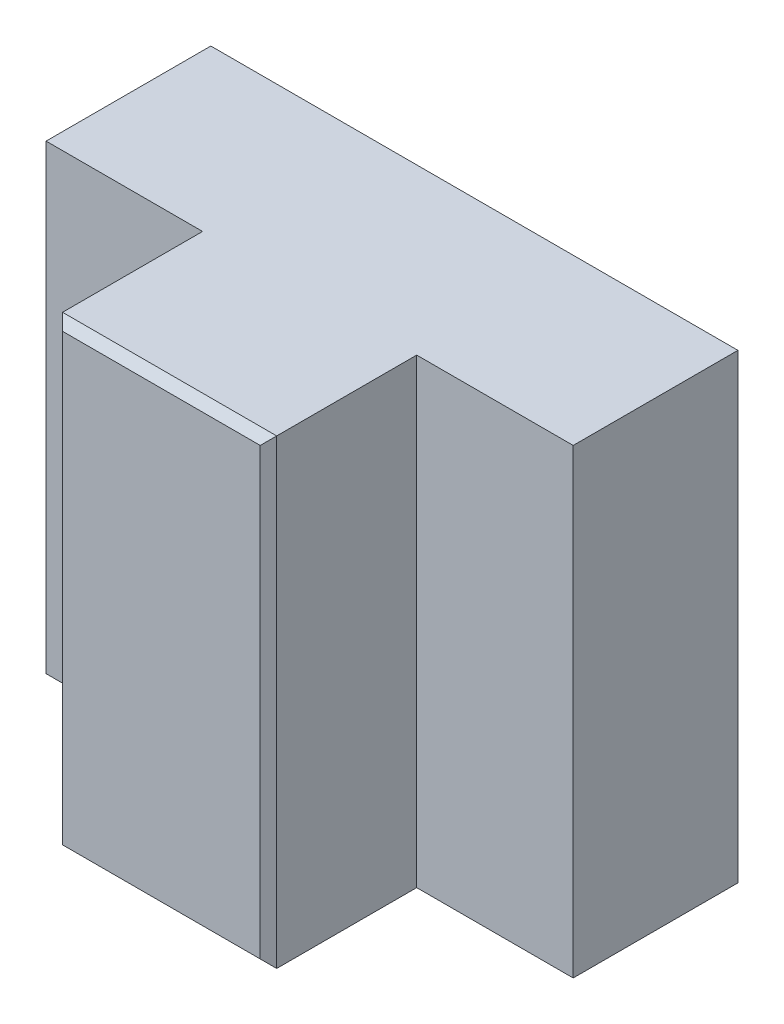
from build123d import *

# Parameters (mm, degrees)
SKETCH_5_W      = 32
SKETCH_5_H      = 28
EXTRUDE_5_DEPTH = 10
EXTRUDE_6_DEPTH = 9
CHAMFER_4_SIZE  = 0.5


with BuildPart() as part:
    # 草图5 → 凸台-拉伸5 (new body)
    with BuildSketch(Plane.XY):
        Rectangle(SKETCH_5_W, SKETCH_5_H)
    extrude(amount=EXTRUDE_5_DEPTH)

    # 草图6 → 凸台-拉伸6 (add)
    with BuildSketch(Plane.XY.offset(10)):
        Polygon((0, 14), (6.5, 14), (6.5, -14), (-6.5, -14), (-6.5, 14), align=None)
    extrude(amount=EXTRUDE_6_DEPTH)

    # 倒角4
    chamfer_4_edges = [part.edges().sort_by_distance(p)[0] for p in [
        (0, 14, 19),
        (-6.5, 0, 19),
        (0, -14, 19),
        (6.5, 0, 19),
    ]]
    chamfer(chamfer_4_edges, length=CHAMFER_4_SIZE)


solid = part.part
